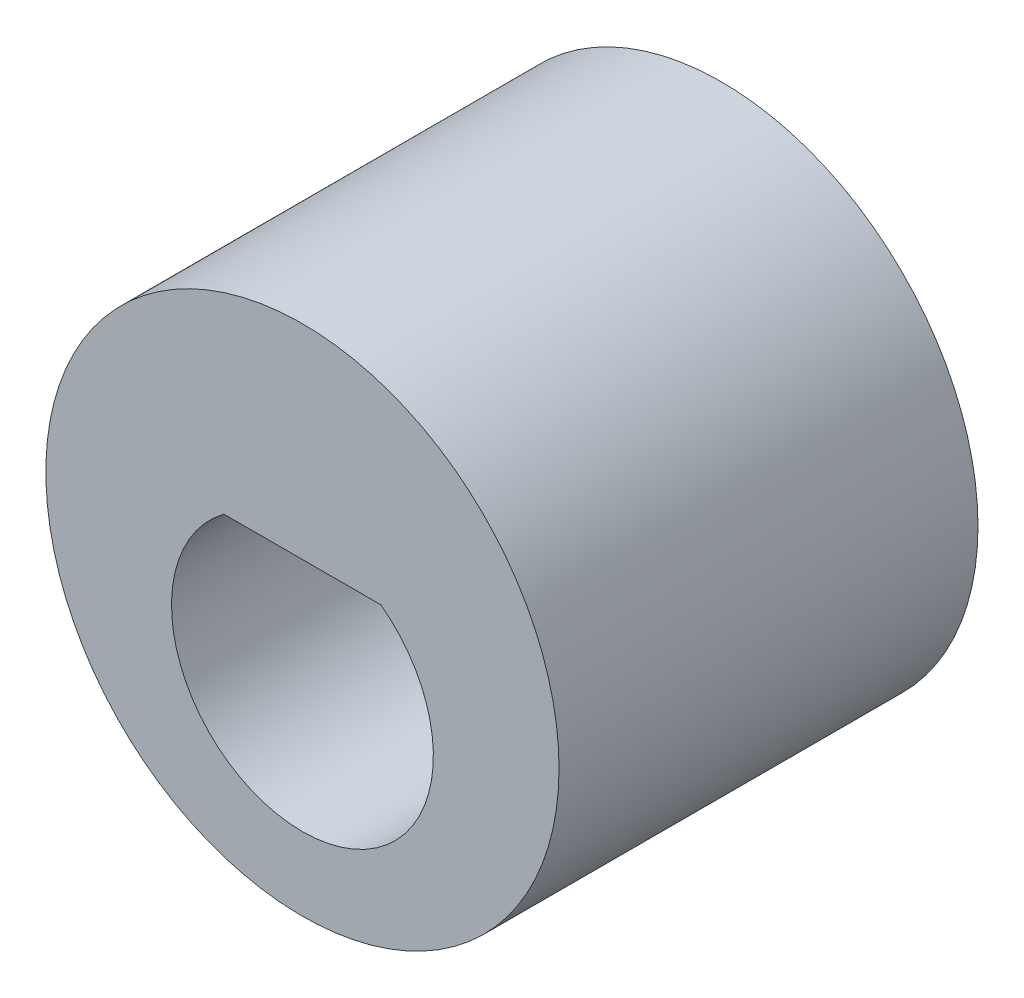
from build123d import *

# Parameters (mm, degrees)
ESQUISSE1_R        = 4.9
BOSS_EXTRU_1_DEPTH = 8


with BuildPart() as part:
    # Esquisse1 → Boss.-Extru.1 (new body)
    with BuildSketch(Plane.XY):
        with Locations((0, 1)):
            Circle(ESQUISSE1_R)
        with BuildLine():
            Line((-1.5, 2), (1.5, 2))
            ThreePointArc((1.5, 2), (0, -2.5), (-1.5, 2))
        make_face(mode=Mode.SUBTRACT)
    extrude(amount=BOSS_EXTRU_1_DEPTH)


solid = part.part
